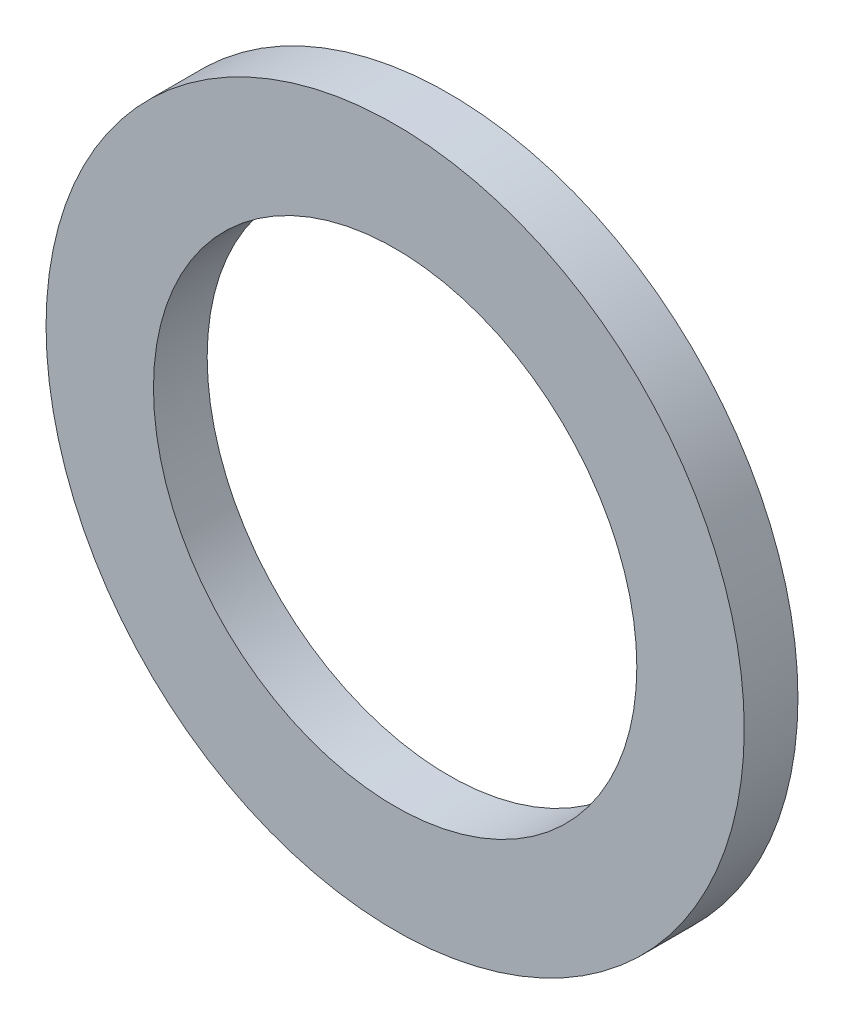
from build123d import *

# Parameters (mm, degrees)
SKETCH_3_R      = 13
SKETCH_3_R_2    = 9
EXTRUDE_1_DEPTH = 2


with BuildPart() as part:
    # 草图3 → 凸台-拉伸1 (new body)
    with BuildSketch(Plane.XY):
        Circle(SKETCH_3_R)
        Circle(SKETCH_3_R_2, mode=Mode.SUBTRACT)
    extrude(amount=EXTRUDE_1_DEPTH)


solid = part.part
